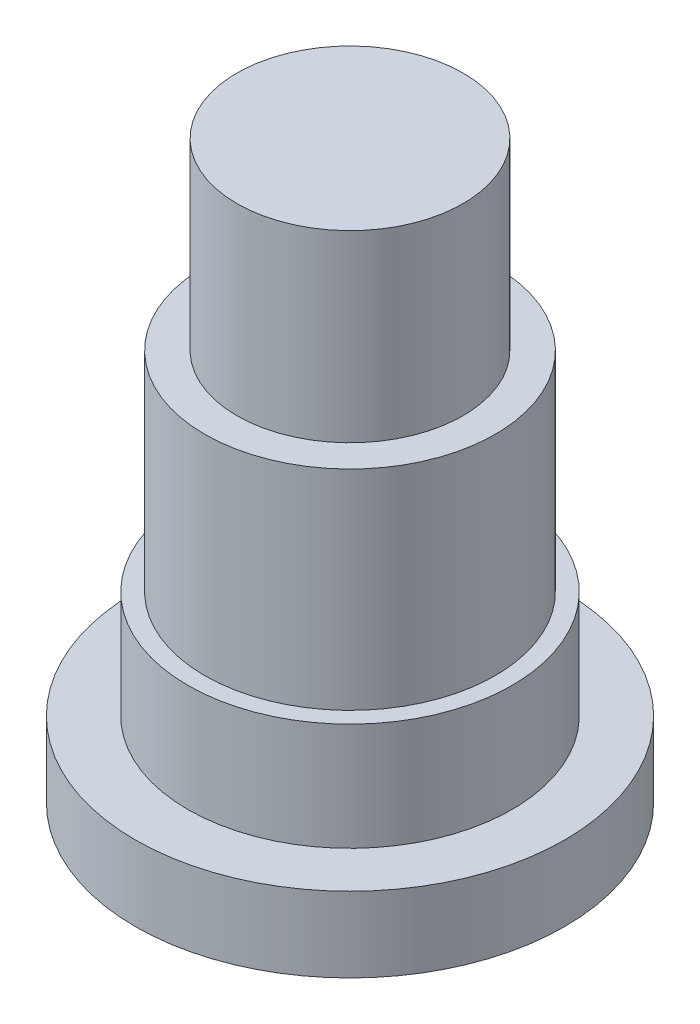
from build123d import *


with BuildPart() as part:
    # Esquisse1 → Révolution1 (revolve)
    with BuildSketch(Plane.XY, mode=Mode.PRIVATE) as r_volution1_sk:
        Polygon((0, 0), (19.865, 0), (19.865, 6.95), (15, 6.95), (15, 16.9), (13.44, 16.9), (13.44, 36.24), (10.465, 36.24), (10.465, 53.24), (0, 53.24), align=None)
    revolve(r_volution1_sk.sketch.rotate(Axis((0, 53.24, 0), (0, -1, 0)), 90), axis=Axis((0, 53.24, 0), (0, -1, 0)))


solid = part.part
